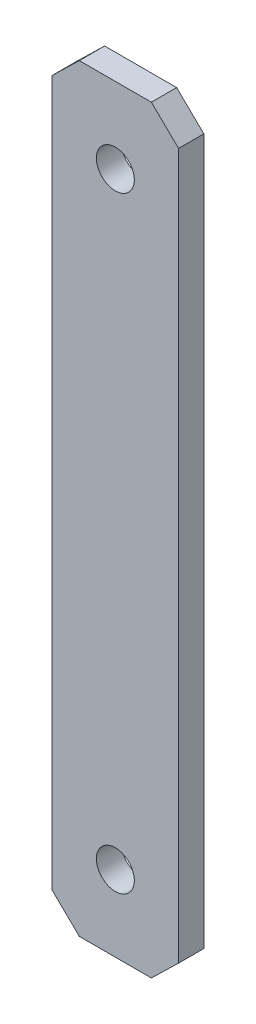
from build123d import *

# Parameters (mm, degrees)
ESTRUSIONE_ESTRUSIONE1_DEPTH = 2
SCHIZZO2_R                   = 1.5
TAGLIO_ESTRUSIONE1_DEPTH     = 59.798875742


with BuildPart() as part:
    # Schizzo1 → Estrusione-Estrusione1 (new body)
    with BuildSketch(Plane.XY):
        Polygon((0, 55.815504809), (2.15, 57.907752405), (7.85, 57.907752405), (10, 55.815504809), (10, 0), (7.85, -2.092247595), (2.15, -2.092247595), (0, 0), align=None)
    extrude(amount=-ESTRUSIONE_ESTRUSIONE1_DEPTH)

    # Schizzo2 → Taglio-Estrusione1 (cut, through all)
    with BuildSketch(Plane.XY):
        with Locations((5, 51.907752405)):
            Circle(SCHIZZO2_R)
        with Locations((5, 3.907752405)):
            Circle(SCHIZZO2_R)
    extrude(amount=-TAGLIO_ESTRUSIONE1_DEPTH, mode=Mode.SUBTRACT)


solid = part.part
